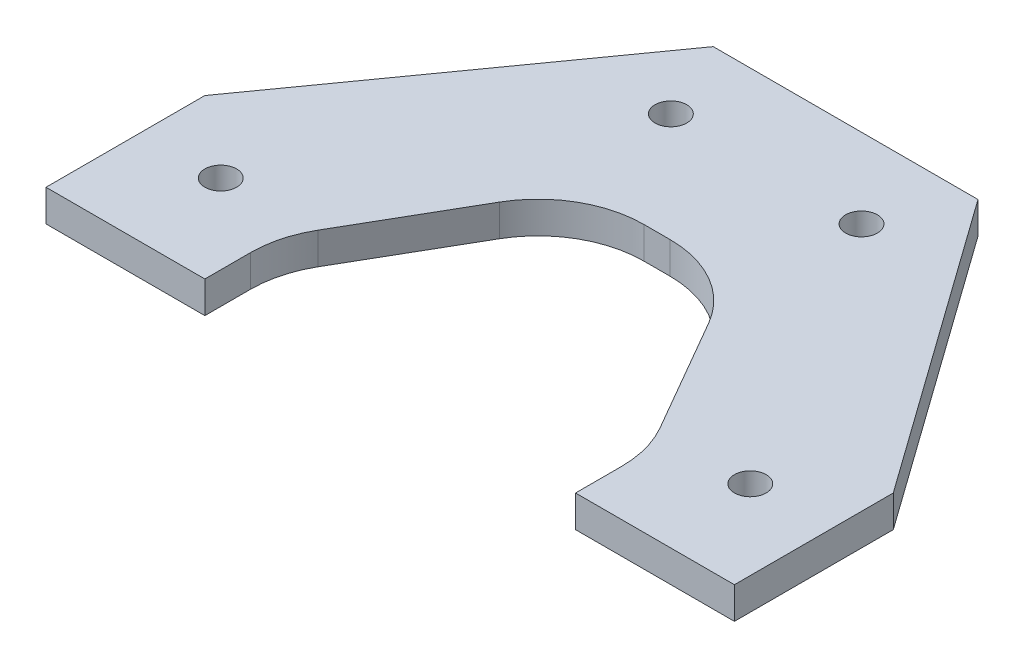
from build123d import *

# Parameters (mm, degrees)
EXTRUDE_1_DEPTH     = 3
SKETCH_2_R          = 1.5
CUT_EXTRUDE_1_DEPTH = 3


with BuildPart() as part:
    # 草图1 → 凸台-拉伸1 (new body)
    with BuildSketch(Plane(origin=(0, 0, 0), x_dir=(1, 0, 0), z_dir=(0, 1, 0))):
        with BuildLine():
            Line((0, 0), (25, 0))
            Line((25, 0), (45, -28))
            Line((45, -28), (45, -43))
            Line((45, -43), (30, -43))
            Line((30, -43), (30, -38.679491924))
            ThreePointArc((30, -38.679491924), (29.659258263, -36.091301473), (28.660254038, -33.679491924))
            Line((28.660254038, -33.679491924), (22.386751346, -22.813466521))
            ThreePointArc((22.386751346, -22.813466521), (18.726497308, -19.153212483), (13.726497308, -17.813466521))
            Line((13.726497308, -17.813466521), (11.273502692, -17.813466521))
            ThreePointArc((11.273502692, -17.813466521), (6.273502692, -19.153212483), (2.613248654, -22.813466521))
            Line((2.613248654, -22.813466521), (-3.660254038, -33.679491924))
            ThreePointArc((-3.660254038, -33.679491924), (-4.659258263, -36.091301473), (-5, -38.679491924))
            Line((-5, -38.679491924), (-5, -43))
            Line((-5, -43), (-20, -43))
            Line((-20, -43), (-20, -28))
            Line((-20, -28), (0, 0))
        make_face()
    extrude(amount=EXTRUDE_1_DEPTH)

    # 草图2 → 切除-拉伸1 (cut)
    with BuildSketch(Plane(origin=(0, 3, 0), x_dir=(1, 0, 0), z_dir=(0, 1, 0))):
        with Locations(Location((-12.5, -34, 0), (0, 0, 270))):
            Circle(SKETCH_2_R)
        with Locations(Location((37.5, -34, 0), (0, 0, 270))):
            Circle(SKETCH_2_R)
        with Locations(Location((3.5, -7.5, 0), (0, 0, 270))):
            Circle(SKETCH_2_R)
        with Locations(Location((21.5, -7.5, 0), (0, 0, 270))):
            Circle(SKETCH_2_R)
    extrude(amount=-CUT_EXTRUDE_1_DEPTH, mode=Mode.SUBTRACT)


solid = part.part
